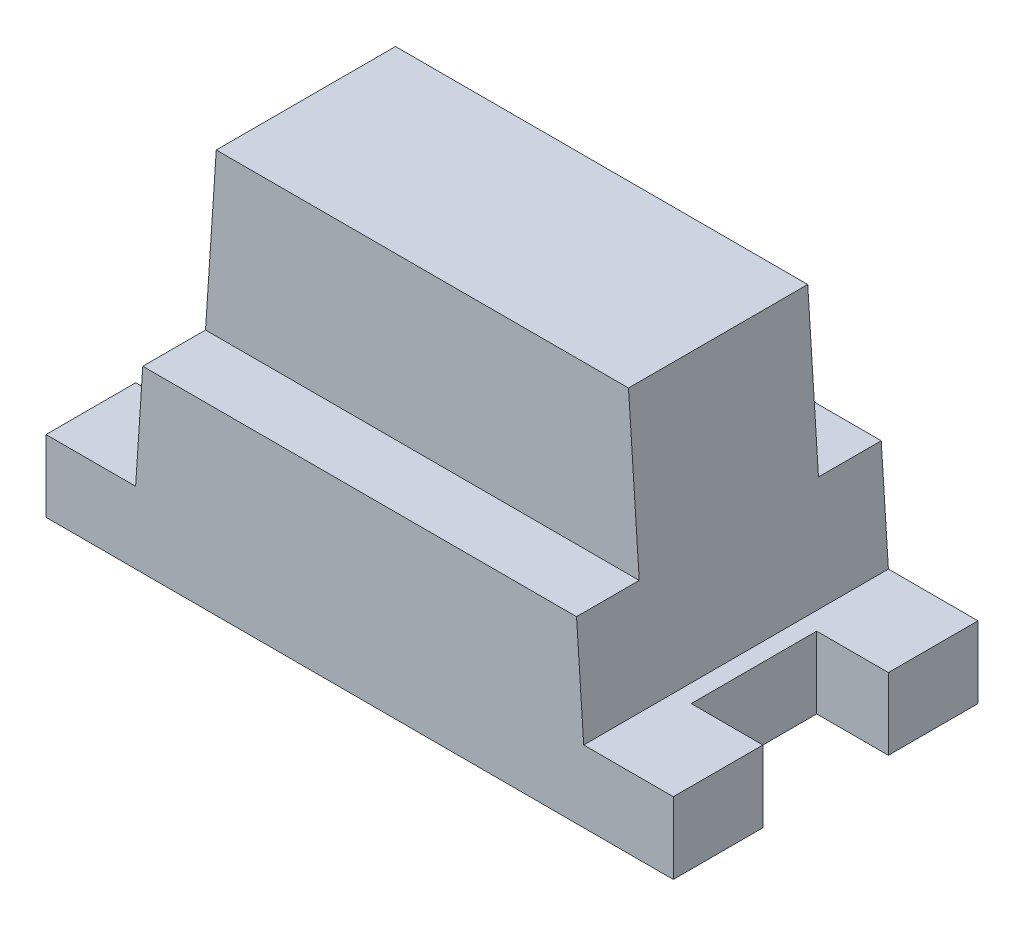
from build123d import *

# Parameters (mm, degrees)
BOSS_EXTRUDE1_DEPTH      = 17
BOSS_EXTRUDE1_DEPTH_BACK = 17
BOSS_EXTRUDE2_DEPTH      = 10
BOSS_EXTRUDE2_DEPTH_BACK = 10
SKETCH3_W                = 14
SKETCH3_H                = 8
CUT_EXTRUDE1_DEPTH       = 8
SKETCH4_W                = 14
SKETCH4_H                = 8
CUT_EXTRUDE2_DEPTH       = 8


with BuildPart() as part:
    # Sketch1 → Boss-Extrude1 (new, two sides: drawn at the far end of the back side and taken through both)
    with BuildSketch(Plane.XY.offset(-BOSS_EXTRUDE1_DEPTH_BACK)):
        Polygon((-37.863126543, -10.682367572), (-38.663126543, -22.682367572), (-48.663126543, -22.682367572), (-48.663126543, -30.682367572), (21.336873457, -30.682367572), (21.336873457, -22.682367572), (11.336873457, -22.682367572), (10.536873457, -10.682367572), align=None)
    extrude(amount=BOSS_EXTRUDE1_DEPTH + BOSS_EXTRUDE1_DEPTH_BACK)

    # Sketch1<3> → Boss-Extrude2 (add, two sides: drawn at the far end of the back side and taken through both)
    with BuildSketch(Plane.XY.offset(-BOSS_EXTRUDE2_DEPTH_BACK)):
        Polygon((-36.663126543, 7.317632428), (-37.863126543, -10.682367572), (10.536873457, -10.682367572), (9.336873457, 7.317632428), align=None)
    extrude(amount=BOSS_EXTRUDE2_DEPTH + BOSS_EXTRUDE2_DEPTH_BACK)

    # Sketch3 → Cut-Extrude1 (cut)
    with BuildSketch(Plane(origin=(21.336873457, 0, 0), x_dir=(0, 0, -1), z_dir=(1, 0, 0))):
        with Locations((0, -26.682367572)):
            Rectangle(SKETCH3_W, SKETCH3_H)
    extrude(amount=-CUT_EXTRUDE1_DEPTH, mode=Mode.SUBTRACT)

    # Sketch4 → Cut-Extrude2 (cut)
    with BuildSketch(Plane.ZY.offset(48.663126543)):
        with Locations((0, -26.682367572)):
            Rectangle(SKETCH4_W, SKETCH4_H)
    extrude(amount=-CUT_EXTRUDE2_DEPTH, mode=Mode.SUBTRACT)


solid = part.part
